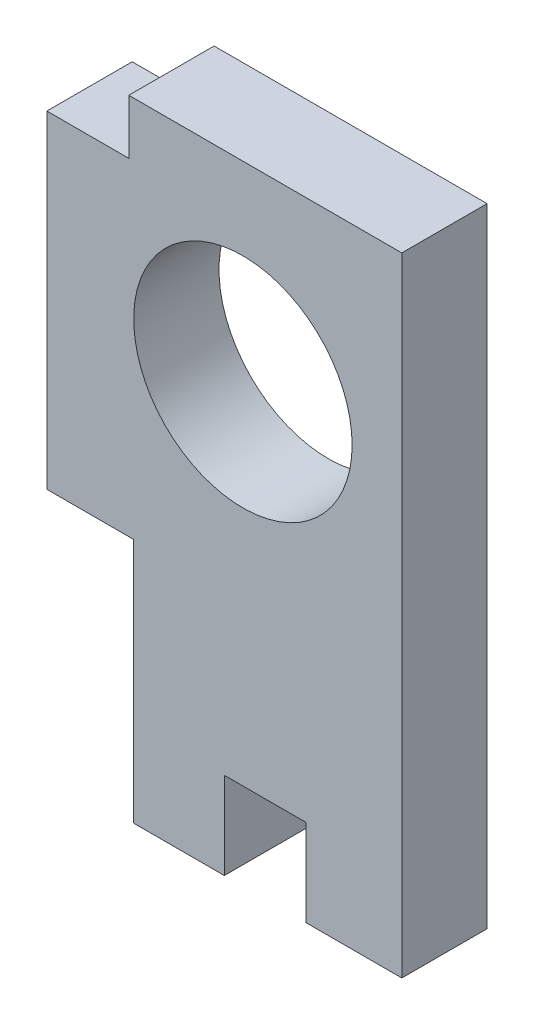
from build123d import *

# Parameters (mm, degrees)
SKETCH2_R           = 4
BOSS_EXTRUDE1_DEPTH = 3.125


with BuildPart() as part:
    # Sketch2 → Boss-Extrude1 (new body)
    with BuildSketch(Plane.XY):
        Polygon((0, 9.5), (3, 9.5), (3, 11.5), (13, 11.5), (13, -11.5), (9.5, -11.5), (9.5, -8.32), (6.5, -8.32), (6.5, -11.5), (3.18, -11.5), (3.18, -2.5), (0, -2.5), align=None)
        with Locations((7.18, 4.5)):
            Circle(SKETCH2_R, mode=Mode.SUBTRACT)
    extrude(amount=BOSS_EXTRUDE1_DEPTH)


solid = part.part
